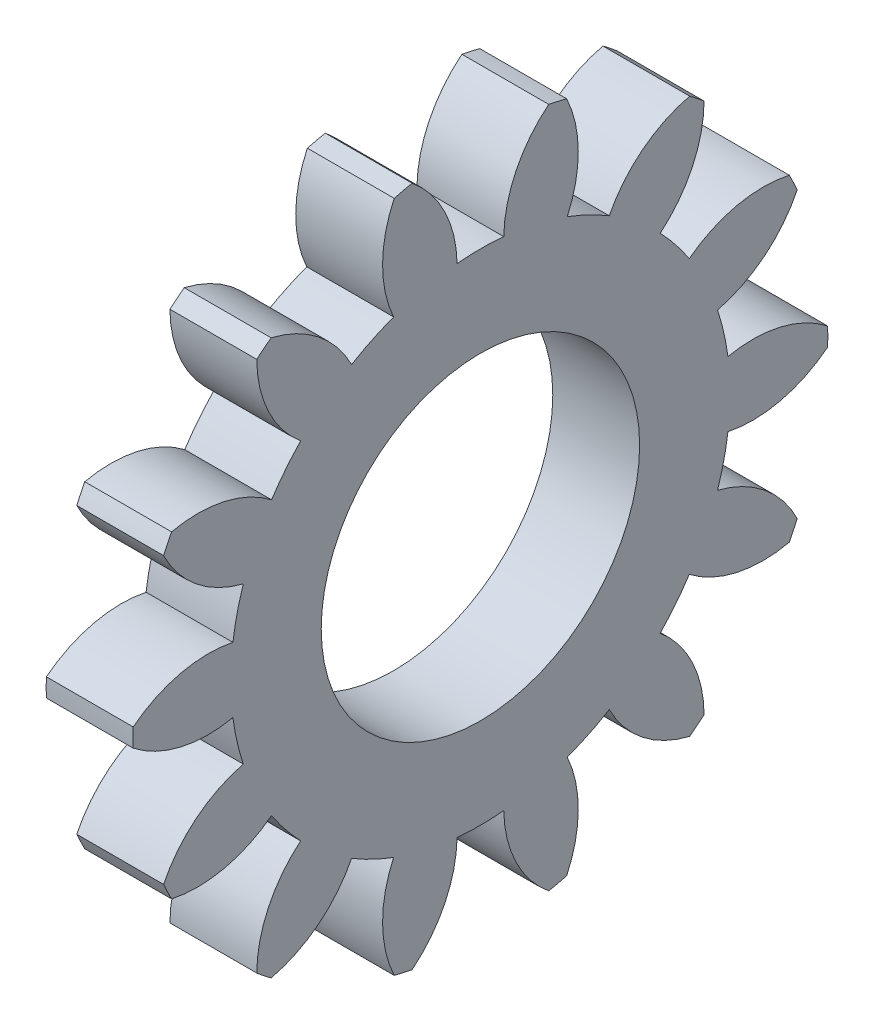
from build123d import *

# Parameters (mm, degrees)
BASPROSKE_W     = 6
BASPROSKE_H     = 24
TOOTHCUT_DEPTH  = 35.467375879
TEETHCUTS_COUNT = 14
TEETHCUTS_ANGLE = 334.285714286
BORSKE_R        = 11
BORE_DEPTH      = 50.0000508


with BuildPart() as part:
    # BasProSke → Base-Revolve (revolve)
    with BuildSketch(Plane(origin=(0, 0, 0), x_dir=(1, 0, 0), z_dir=(0, 1, 0)), mode=Mode.PRIVATE) as base_revolve_sk:
        with Locations((3, 12)):
            Rectangle(BASPROSKE_W, BASPROSKE_H)
    revolve(base_revolve_sk.sketch.rotate(Axis((-10, 0, 0), (1, 0, 0)), 180), axis=Axis((-10, 0, 0), (1, 0, 0)))

    # TooCutSke → ToothCut (cut, through all)
    with BuildSketch(Plane(origin=(0, 0, 0), x_dir=(0, 0, -1), z_dir=(1, 0, 0))):
        with BuildLine():
            ThreePointArc((1.61114962, 17.173590128), (0, 17.249), (-1.61114962, 17.173590128))
            ThreePointArc((-1.61114962, 17.173590128), (-2.470269362, 20.710630663), (-4.744995334, 23.552173242))
            ThreePointArc((-4.744995334, 23.552173242), (0, 24.0254), (4.744995334, 23.552173242))
            ThreePointArc((4.744995334, 23.552173242), (2.470269362, 20.710630663), (1.61114962, 17.173590128))
        make_face()
    toothcut = extrude(amount=TOOTHCUT_DEPTH, mode=Mode.SUBTRACT)

    # TeethCuts: ToothCut ×14 about axis
    teethcuts_axis = Axis((-10, 0, 0), (1, 0, 0))
    for i in range(1, TEETHCUTS_COUNT):
        add(toothcut.rotate(teethcuts_axis, i * TEETHCUTS_ANGLE / (TEETHCUTS_COUNT - 1)), mode=Mode.SUBTRACT)

    # BorSke → Bore (cut, symmetric)
    with BuildSketch(Plane(origin=(0, 0, 0), x_dir=(0, 0, -1), z_dir=(1, 0, 0))):
        with Locations(Location((0, 0, 0), (0, 0, 180))):
            Circle(BORSKE_R)
    extrude(amount=BORE_DEPTH, both=True, mode=Mode.SUBTRACT)


solid = part.part
